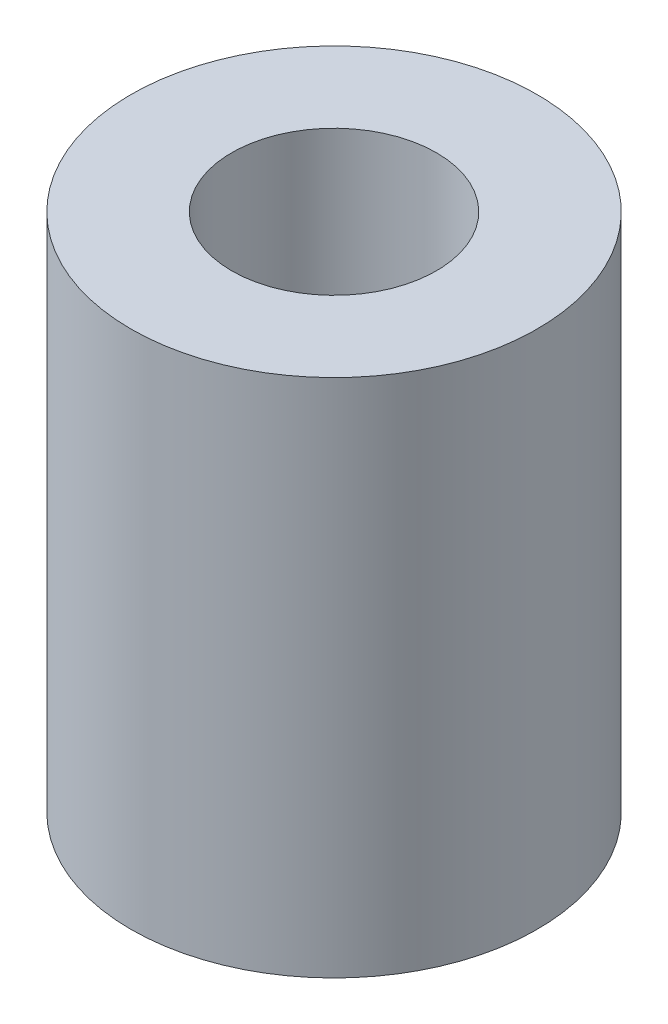
from build123d import *

# Parameters (mm, degrees)
SKETCH1_R           = 7.9375
BOSS_EXTRUDE1_DEPTH = 20.32
SKETCH3_R           = 4
CUT_EXTRUDE2_DEPTH  = 24.214439741


with BuildPart() as part:
    # Sketch1 → Boss-Extrude1 (new body)
    with BuildSketch(Plane(origin=(0, 0, 0), x_dir=(1, 0, 0), z_dir=(0, 1, 0))):
        with Locations(Location((0, 0, 0), (0, 0, 270))):
            Circle(SKETCH1_R)
    extrude(amount=BOSS_EXTRUDE1_DEPTH)

    # Sketch3 → Cut-Extrude2 (cut, through all)
    with BuildSketch(Plane(origin=(0, 20.32, 0), x_dir=(1, 0, 0), z_dir=(0, 1, 0))):
        with Locations(Location((0, 0, 0), (0, 0, 270))):
            Circle(SKETCH3_R)
    extrude(amount=-CUT_EXTRUDE2_DEPTH, mode=Mode.SUBTRACT)


solid = part.part
